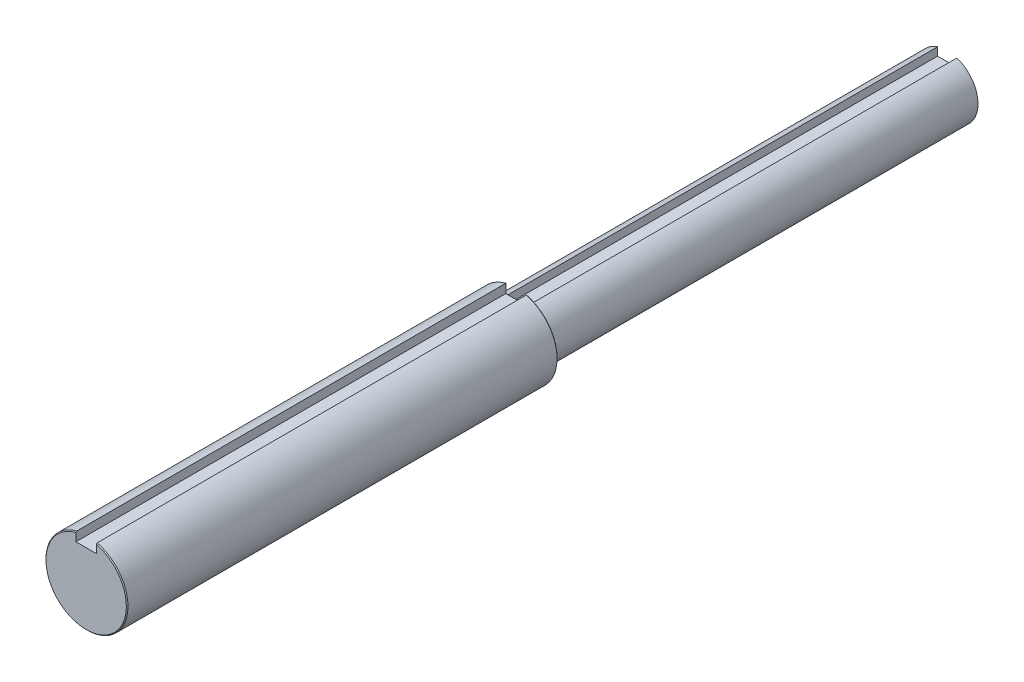
from build123d import *

# Parameters (mm, degrees)
BOSS_EXTRUDE1_DEPTH      = 304.8
BOSS_EXTRUDE1_DEPTH_BACK = 304.8
CHAMFER1_SIZE            = 0.254
SKETCH5_R                = 12.7
SKETCH5_R_2              = 9.525
CUT_EXTRUDE1_DEPTH       = 477.588546337
SKETCH6_W                = 6
SKETCH6_H                = 6
CUT_EXTRUDE2_DEPTH       = 477.588546337
CHAMFER2_SIZE            = 0.2
SKETCH7_R                = 63.5
CUT_EXTRUDE3_DEPTH       = 344.370048199


with BuildPart() as part:
    # Sketch3 → Boss-Extrude1 (new, two sides: drawn at the far end of the back side and taken through both)
    with BuildSketch(Plane.XY.offset(-BOSS_EXTRUDE1_DEPTH_BACK)):
        with BuildLine():
            Line((-3.175, 9.525), (-3.175, 12.296722124))
            ThreePointArc((-3.175, 12.296722124), (0, -12.7), (3.175, 12.296722124))
            Line((3.175, 12.296722124), (3.175, 9.525))
            Line((3.175, 9.525), (-3.175, 9.525))
        make_face()
    extrude(amount=BOSS_EXTRUDE1_DEPTH + BOSS_EXTRUDE1_DEPTH_BACK)

    # Chamfer1
    chamfer1_edges = [part.edges().sort_by_distance(p)[0] for p in [
        (0, -12.7, -304.8),
        (0, -12.7, 304.8),
    ]]
    chamfer(chamfer1_edges, length=CHAMFER1_SIZE)

    # Sketch5 → Cut-Extrude1 (cut, through all)
    with BuildSketch(Plane.XY.offset(171.45)):
        Circle(SKETCH5_R)
        Circle(SKETCH5_R_2, mode=Mode.SUBTRACT)
    extrude(amount=-CUT_EXTRUDE1_DEPTH, mode=Mode.SUBTRACT)

    # Sketch6 → Cut-Extrude2 (cut, through all)
    with BuildSketch(Plane.XY.offset(171.45)):
        with Locations((0, 9.525)):
            Rectangle(SKETCH6_W, SKETCH6_H)
    extrude(amount=-CUT_EXTRUDE2_DEPTH, mode=Mode.SUBTRACT)

    # Chamfer2
    chamfer2_edges = [part.edges().sort_by_distance(p)[0] for p in [
        (-3.175, 10.910861062, 171.45),
        (0, -12.7, 171.45),
        (3.175, 10.910861062, 171.45),
        (0, 9.525, 171.45),
        (0, -9.525, 171.45),
        (-3, 7.782611309, 171.45),
        (0, 6.525, 171.45),
        (3, 7.782611309, 171.45),
    ]]
    chamfer(chamfer2_edges, length=CHAMFER2_SIZE)

    # Sketch7 → Cut-Extrude3 (cut, through all)
    with BuildSketch(Plane.XY.offset(38.1)):
        Circle(SKETCH7_R)
    extrude(amount=-CUT_EXTRUDE3_DEPTH, mode=Mode.SUBTRACT)


solid = part.part
